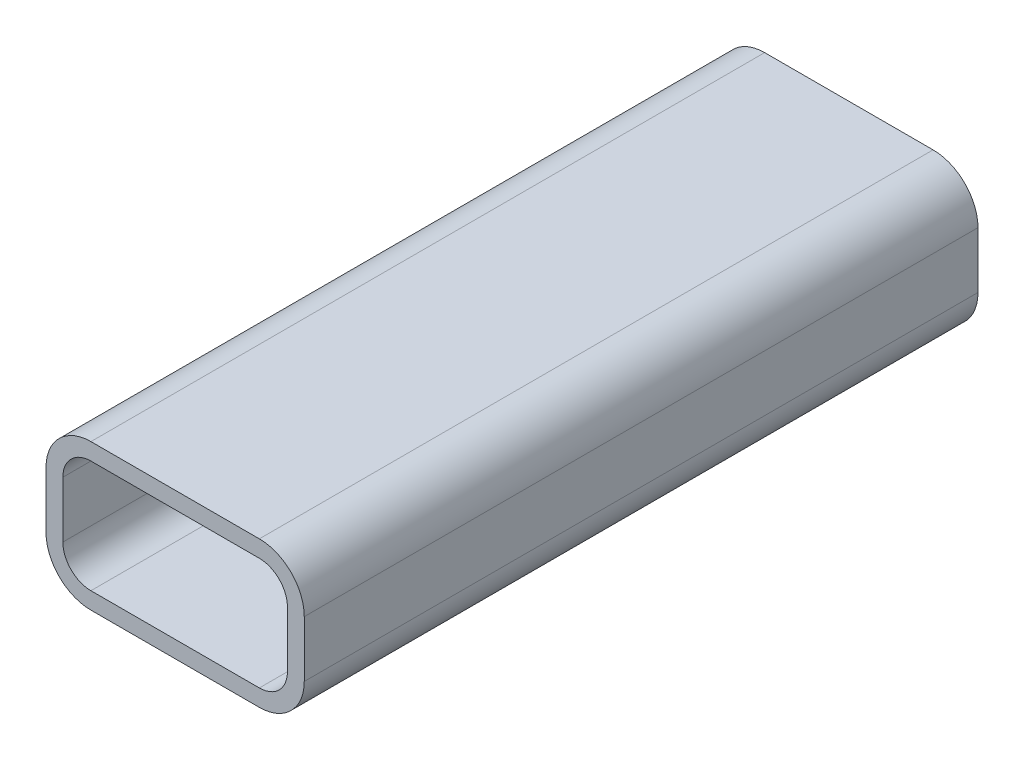
from build123d import *

# Parameters (mm, degrees)
EXTRUDE_THIN1_DEPTH = 60


with BuildPart() as part:
    # Sketch1 → Extrude-Thin1 (new, symmetric)
    with BuildSketch(Plane.XY):
        with BuildLine():
            Line((15, 13), (-15, 13))
            ThreePointArc((-15, 13), (-20.656854249, 10.656854249), (-23, 5))
            Line((-23, 5), (-23, -5))
            ThreePointArc((-23, -5), (-20.656854249, -10.656854249), (-15, -13))
            Line((-15, -13), (15, -13))
            ThreePointArc((15, -13), (20.656854249, -10.656854249), (23, -5))
            Line((23, -5), (23, 5))
            ThreePointArc((23, 5), (20.656854249, 10.656854249), (15, 13))
        make_face()
        with BuildLine():
            Line((15, 10), (-15, 10))
            ThreePointArc((-15, 10), (-18.535533906, 8.535533906), (-20, 5))
            Line((-20, 5), (-20, -5))
            ThreePointArc((-20, -5), (-18.535533906, -8.535533906), (-15, -10))
            Line((-15, -10), (15, -10))
            ThreePointArc((15, -10), (18.535533906, -8.535533906), (20, -5))
            Line((20, -5), (20, 5))
            ThreePointArc((20, 5), (18.535533906, 8.535533906), (15, 10))
        make_face(mode=Mode.SUBTRACT)
    extrude(amount=EXTRUDE_THIN1_DEPTH, both=True)


solid = part.part
